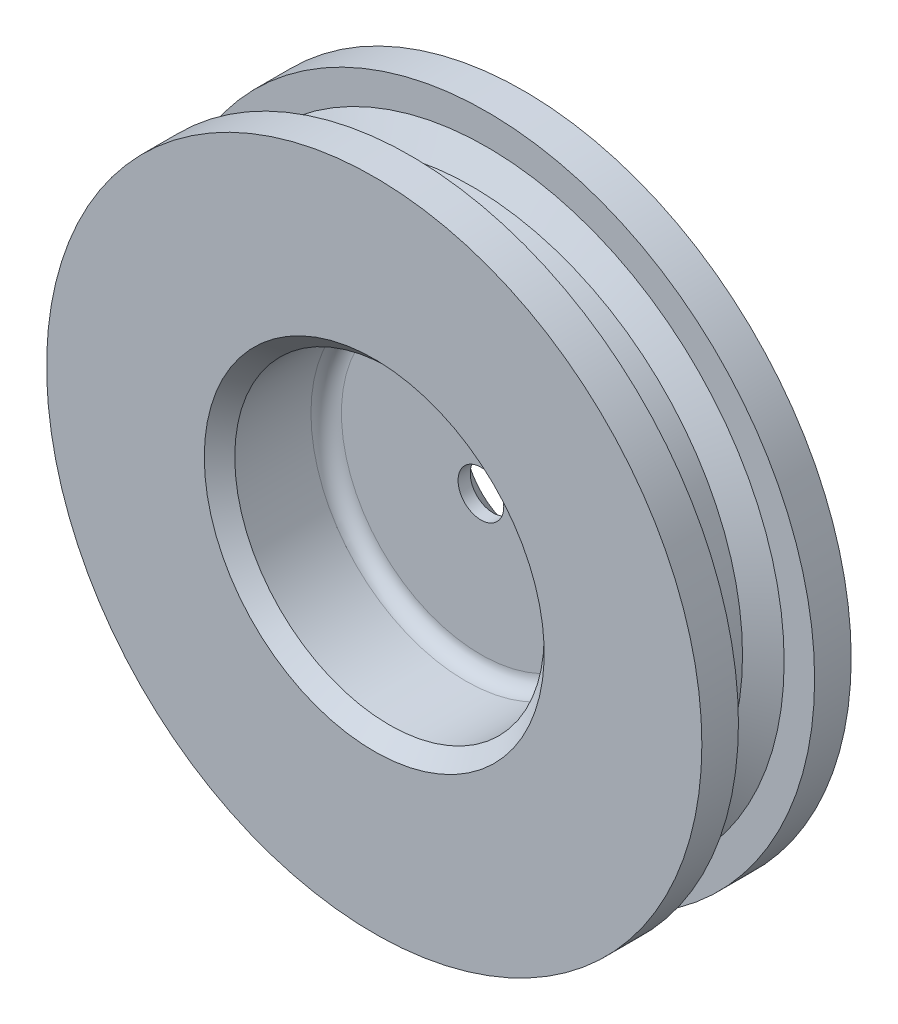
from build123d import *

# Parameters (mm, degrees)
ESBO_O5_R             = 10.153899328
CORTE_EXTRUS_O1_DEPTH = 7
CHANFRO1_SIZE         = 1
FILETE1_R             = 1
CHANFRO2_SIZE         = 2
CHANFRO2_SIZE2        = 2.383507185


with BuildPart() as part:
    # Esboço4 → Revolução1 (revolve)
    with BuildSketch(Plane(origin=(0, 0, 0), x_dir=(0, 0, -1), z_dir=(1, 0, 0)), mode=Mode.PRIVATE) as revolu_o1_sk:
        Polygon((-4.9, 0), (-4.9, 20), (-2.5, 20), (-2.5, 18), (-1.5, 16.267949192), (0, 16.267949192), (1.5, 16.267949192), (2.5, 18), (2.5, 20), (4.9, 20), (4.9, 0), align=None)
    revolve(revolu_o1_sk.sketch.rotate(Axis((0, -1.5, 9.058267024), (0, 0, -1)), 90), axis=Axis((0, -1.5, 9.058267024), (0, 0, -1)))

    # Esboço5 → Corte-extrusão1 (cut)
    with BuildSketch(Plane.XY.offset(4.9)):
        with Locations((0, -1.5)):
            Circle(ESBO_O5_R)
    extrude(amount=-CORTE_EXTRUS_O1_DEPTH, mode=Mode.SUBTRACT)

    # Chanfro1
    chanfro1_edges = [part.edges().sort_by_distance(p)[0] for p in [
        (-10.153899328, -1.5, 4.9),
    ]]
    chamfer(chanfro1_edges, length=CHANFRO1_SIZE)

    # Filete1
    filete1_edges = [part.edges().sort_by_distance(p)[0] for p in [
        (-10.153899328, -1.5, -2.1),
    ]]
    fillet(filete1_edges, radius=FILETE1_R)

    # Chanfro2
    chanfro2_edges = [part.edges().sort_by_distance(p)[0] for p in [
        (-1.5, -1.5, -4.9),
    ]]
    chanfro2_side = [part.faces().sort_by_distance(p)[0] for p in [
        (-1.5, -1.5, -3.5),
    ]]
    chamfer(chanfro2_edges, length=CHANFRO2_SIZE, length2=CHANFRO2_SIZE2, reference=chanfro2_side[0])


solid = part.part
